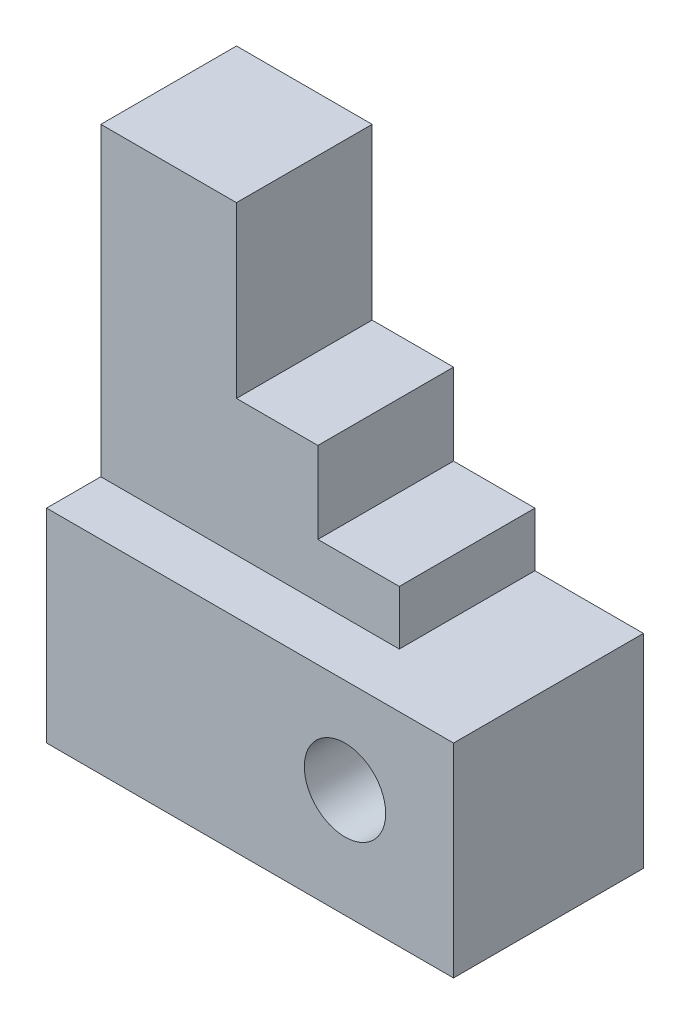
from build123d import *

# Parameters (mm, degrees)
SKETCH1_W           = 60
SKETCH1_H           = 30
SKETCH1_R           = 6
BOSS_EXTRUDE1_DEPTH = 28
BOSS_EXTRUDE2_DEPTH = 20


with BuildPart() as part:
    # Sketch1 → Boss-Extrude1 (new body)
    with BuildSketch(Plane.XY):
        with Locations((30, 15)):
            Rectangle(SKETCH1_W, SKETCH1_H)
        with Locations((44, 16)):
            Circle(SKETCH1_R, mode=Mode.SUBTRACT)
    extrude(amount=BOSS_EXTRUDE1_DEPTH)

    # Sketch3 → Boss-Extrude2 (add)
    with BuildSketch(Plane.XY):
        Polygon((0, 30), (0, 75), (20, 75), (20, 50), (32, 50), (32, 38), (44, 38), (44, 30), align=None)
    extrude(amount=BOSS_EXTRUDE2_DEPTH)


solid = part.part
